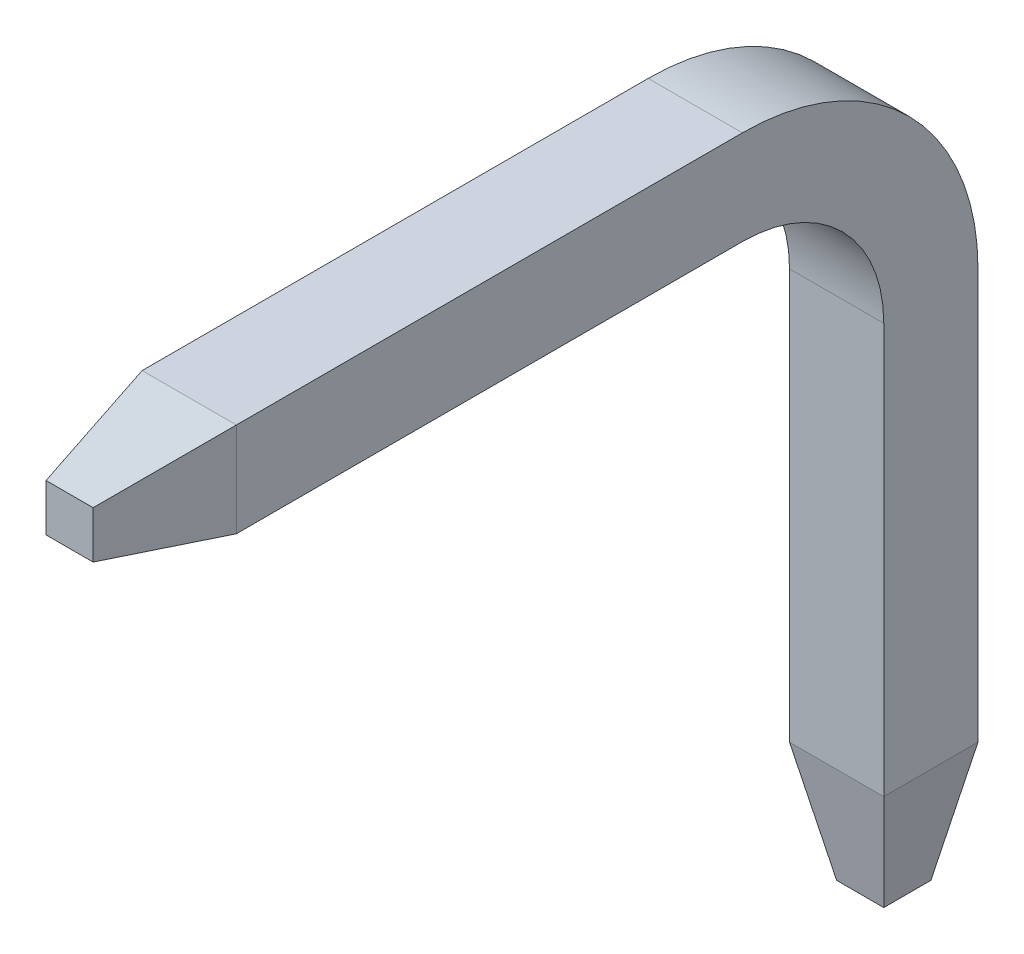
from build123d import *
from OCP.BRepFilletAPI import BRepFilletAPI_MakeChamfer

# Parameters (mm, degrees)
BOSS_EXTRUDE1_DEPTH = 0.5
CHAMFER1_SIZE       = 1.27
CHAMFER1_SIZE2      = 0.25
CHAMFER2_SIZE       = 0.25
CHAMFER2_SIZE2      = 1.27


with BuildPart() as part:
    # Sketch1 → Boss-Extrude1 (new, symmetric)
    with BuildSketch(Plane(origin=(0, 0, 0), x_dir=(0, 0, -1), z_dir=(1, 0, 0))):
        with BuildLine():
            Line((0.5, -2), (0.5, -7.62))
            Line((0.5, -7.62), (-0.5, -7.62))
            Line((-0.5, -7.62), (-0.5, -2))
            ThreePointArc((-0.5, -2), (-0.939339828, -0.939339828), (-2, -0.5))
            Line((-2, -0.5), (-8.64, -0.5))
            Line((-8.64, -0.5), (-8.64, 0.5))
            Line((-8.64, 0.5), (-2, 0.5))
            ThreePointArc((-2, 0.5), (-0.232233047, -0.232233047), (0.5, -2))
        make_face()
    extrude(amount=BOSS_EXTRUDE1_DEPTH, both=True)

    # Chamfer1: one chamfer whose edges measure the first distance from different faces: ONE call of the kernel's chamfer builder (chamfer() names one face for all edges)
    chamfer1_edges_1 = [part.edges().sort_by_distance(p)[0] for p in [
        (-0.5, 0, 8.64),
    ]]
    chamfer1_side_1 = [part.faces().sort_by_distance(p)[0] for p in [
        (-0.5, -4.81, -0.37774044),
    ]]
    chamfer1_edges_2 = [part.edges().sort_by_distance(p)[0] for p in [
        (0.5, 0, 8.64),
    ]]
    chamfer1_side_2 = [part.faces().sort_by_distance(p)[0] for p in [
        (0.5, -4.81, -0.37774044),
    ]]
    chamfer1_edges_3 = [part.edges().sort_by_distance(p)[0] for p in [
        (0, -0.5, 8.64),
    ]]
    chamfer1_side_3 = [part.faces().sort_by_distance(p)[0] for p in [
        (0, -0.5, 5.32),
    ]]
    chamfer1_edges_4 = [part.edges().sort_by_distance(p)[0] for p in [
        (0, 0.5, 8.64),
    ]]
    chamfer1_side_4 = [part.faces().sort_by_distance(p)[0] for p in [
        (0, 0.5, 5.32),
    ]]
    chamfer1 = BRepFilletAPI_MakeChamfer(part.part.solid().wrapped)
    for e in chamfer1_edges_1:
        chamfer1.Add(CHAMFER1_SIZE, CHAMFER1_SIZE2, e.wrapped, chamfer1_side_1[0].wrapped)  # the first distance lies on this face
    for e in chamfer1_edges_2:
        chamfer1.Add(CHAMFER1_SIZE, CHAMFER1_SIZE2, e.wrapped, chamfer1_side_2[0].wrapped)  # the first distance lies on this face
    for e in chamfer1_edges_3:
        chamfer1.Add(CHAMFER1_SIZE, CHAMFER1_SIZE2, e.wrapped, chamfer1_side_3[0].wrapped)  # the first distance lies on this face
    for e in chamfer1_edges_4:
        chamfer1.Add(CHAMFER1_SIZE, CHAMFER1_SIZE2, e.wrapped, chamfer1_side_4[0].wrapped)  # the first distance lies on this face
    add(Compound.cast(chamfer1.Shape()), mode=Mode.REPLACE)

    # Chamfer2
    chamfer2_edges = [part.edges().sort_by_distance(p)[0] for p in [
        (0, -7.62, -0.5),
        (0, -7.62, 0.5),
        (0.5, -7.62, 0),
        (-0.5, -7.62, 0),
    ]]
    chamfer2_side = [part.faces().sort_by_distance(p)[0] for p in [
        (0, -7.62, 0),
    ]]
    chamfer(chamfer2_edges, length=CHAMFER2_SIZE, length2=CHAMFER2_SIZE2, reference=chamfer2_side[0])


solid = part.part
